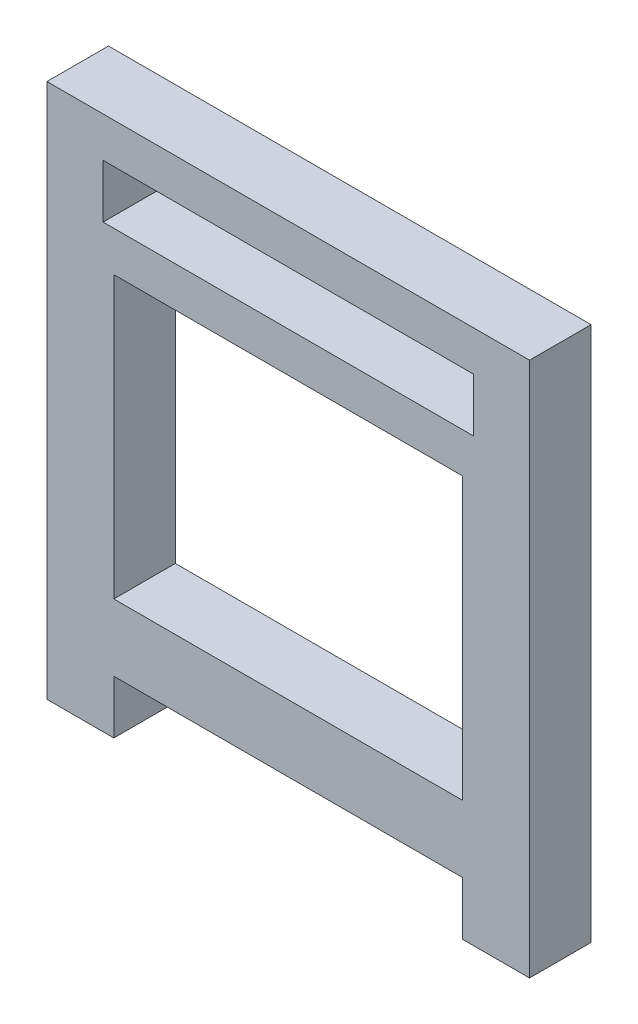
from build123d import *

# Parameters (mm, degrees)
SKETCH1_W           = 13.04
SKETCH1_H           = 10.5
SKETCH1_W_2         = 13.84
SKETCH1_H_2         = 2
BOSS_EXTRUDE1_DEPTH = 2.3


with BuildPart() as part:
    # Sketch1 → Boss-Extrude1 (new body)
    with BuildSketch(Plane.XY):
        Polygon((0, 0), (0, -2), (2.5, -2), (2.5, 0), (15.54, 0), (15.54, -2), (18.04, -2), (18.04, 0), (18.04, 18), (0, 18), align=None)
        with Locations((9.02, 7.75)):
            Rectangle(SKETCH1_W, SKETCH1_H, mode=Mode.SUBTRACT)
        with Locations((9.02, 15.5)):
            Rectangle(SKETCH1_W_2, SKETCH1_H_2, mode=Mode.SUBTRACT)
    extrude(amount=BOSS_EXTRUDE1_DEPTH)


solid = part.part
